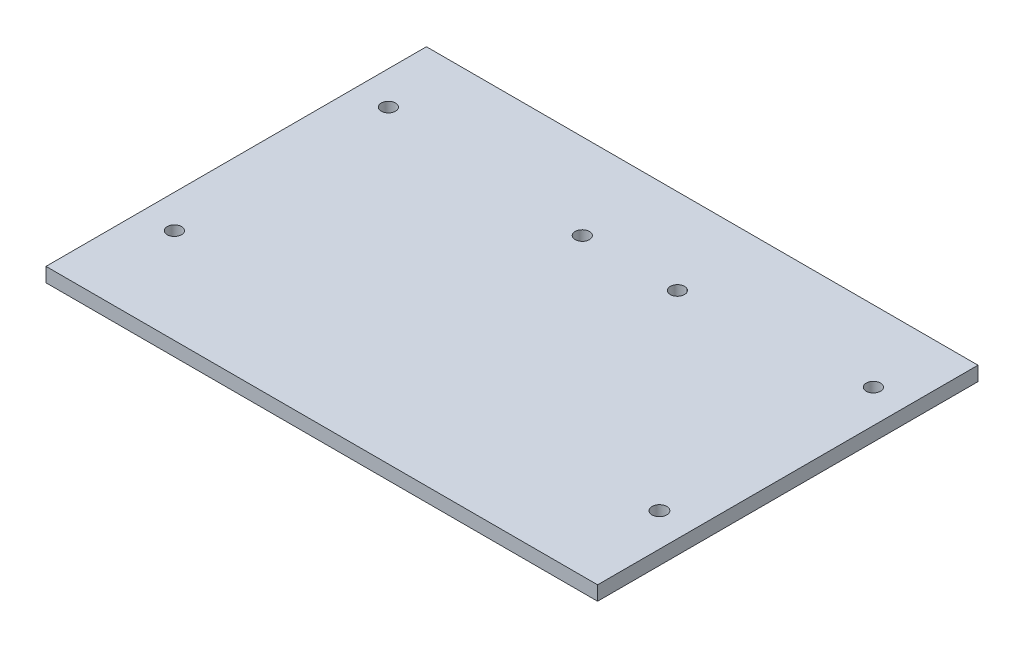
from build123d import *

# Parameters (mm, degrees)
SKETCH_1_W          = 116
SKETCH_1_H          = 80
EXTRUDE_1_DEPTH     = 3
SKETCH_2_R          = 1.5
SKETCH_2_R_2        = 1.55
CUT_EXTRUDE_1_DEPTH = 10
SKETCH_3_R          = 1.5
CUT_EXTRUDE_2_DEPTH = 71.519500849


with BuildPart() as part:
    # 草图1 → 凸台-拉伸1 (new body)
    with BuildSketch(Plane(origin=(0, 0, 0), x_dir=(1, 0, 0), z_dir=(0, 1, 0))):
        Rectangle(SKETCH_1_W, SKETCH_1_H)
    extrude(amount=EXTRUDE_1_DEPTH)

    # 草图2 → 切除-拉伸1 (cut)
    with BuildSketch(Plane.XZ):
        with Locations(Location((-51, 20, 0), (0, 0, 270))):
            Circle(SKETCH_2_R)
        with Locations(Location((51, 20, 0), (0, 0, 270))):
            Circle(SKETCH_2_R_2)
        with Locations(Location((51, -25, 0), (0, 0, 270))):
            Circle(SKETCH_2_R)
        with Locations(Location((-51, -25, 0), (0, 0, 270))):
            Circle(SKETCH_2_R)
    extrude(amount=-CUT_EXTRUDE_1_DEPTH, mode=Mode.SUBTRACT)

    # 草图3 → 切除-拉伸2 (cut, through all)
    with BuildSketch(Plane(origin=(0, 3, 0), x_dir=(1, 0, 0), z_dir=(0, 1, 0))):
        with Locations(Location((-7.215969028, 22, 0), (0, 0, 270))):
            Circle(SKETCH_3_R)
        with Locations(Location((12.784030972, 22, 0), (0, 0, 270))):
            Circle(SKETCH_3_R)
    extrude(amount=-CUT_EXTRUDE_2_DEPTH, mode=Mode.SUBTRACT)


solid = part.part
